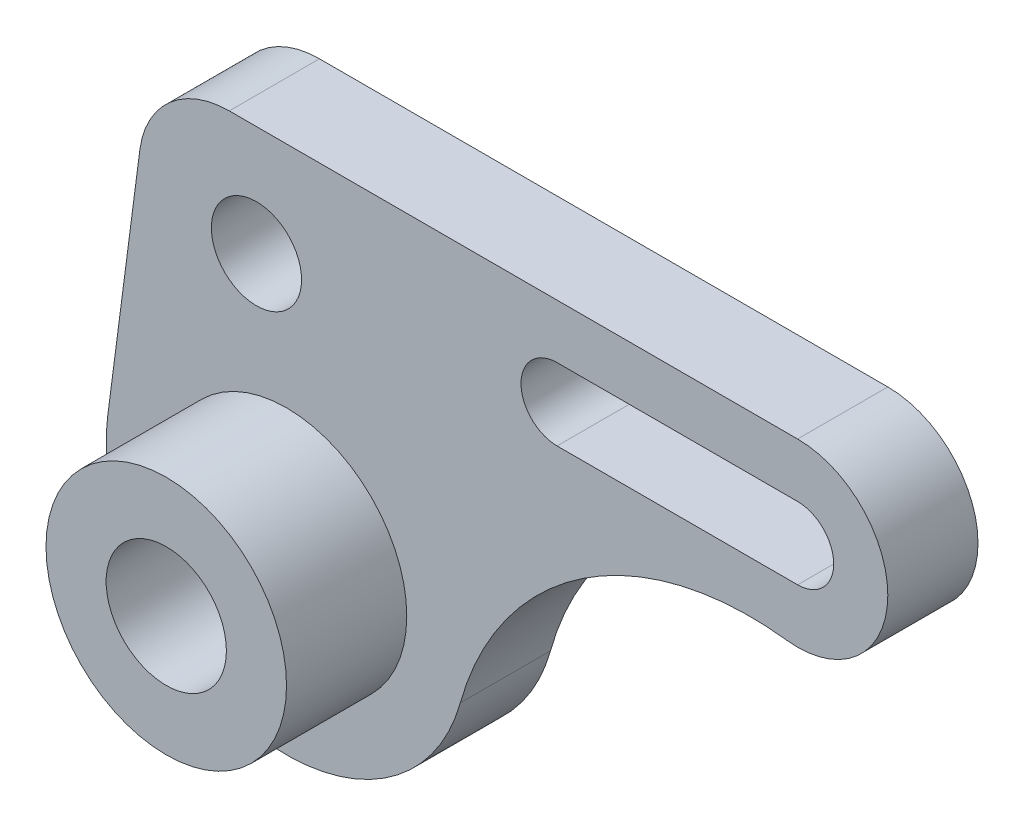
from build123d import *

# Parameters (mm, degrees)
BOSS_EXTRUDE1_DEPTH = 15
SKETCH2_R           = 7.5
CUT_EXTRUDE1_DEPTH  = 15
SKETCH3_R           = 20
BOSS_EXTRUDE2_DEPTH = 20
SKETCH4_R           = 10
CUT_EXTRUDE2_DEPTH  = 35


with BuildPart() as part:
    # Sketch1 → Boss-Extrude1 (new body)
    with BuildSketch(Plane.XY):
        with BuildLine():
            Line((-29.748120578, 3.87934557), (-24.393431116, 44.940897042))
            ThreePointArc((-24.393431116, 44.940897042), (-19.416464042, 54.272761237), (-9.519370827, 58.001224257))
            Line((-9.519370827, 58.001224257), (85, 58.001224257))
            ThreePointArc((85, 58.001224257), (99.971845495, 42.082615269), (83.166230421, 28.113736587))
            ThreePointArc((83.166230421, 28.113736587), (49.31881051, 20.091395843), (28.895124435, -8.066708368))
            ThreePointArc((28.895124435, -8.066708368), (-5.988234446, -29.396276095), (-29.748120578, 3.87934557))
        make_face()
    extrude(amount=BOSS_EXTRUDE1_DEPTH)

    # Sketch2 → Cut-Extrude1 (cut)
    with BuildSketch(Plane.XY.offset(15)):
        with BuildLine():
            Line((45, 37.001224257), (85, 37.001224257))
            ThreePointArc((85, 37.001224257), (91, 43.001224257), (85, 49.001224257))
            Line((85, 49.001224257), (45, 49.001224257))
            ThreePointArc((45, 49.001224257), (39, 43.001224257), (45, 37.001224257))
        make_face()
        with Locations((-5, 39.686269666)):
            Circle(SKETCH2_R)
    extrude(amount=-CUT_EXTRUDE1_DEPTH, mode=Mode.SUBTRACT)

    # Sketch3 → Boss-Extrude2 (add)
    with BuildSketch(Plane.XY.offset(15)):
        Circle(SKETCH3_R)
    extrude(amount=BOSS_EXTRUDE2_DEPTH)

    # Sketch4 → Cut-Extrude2 (cut)
    with BuildSketch(Plane.XY.offset(35)):
        Circle(SKETCH4_R)
    extrude(amount=-CUT_EXTRUDE2_DEPTH, mode=Mode.SUBTRACT)


solid = part.part
